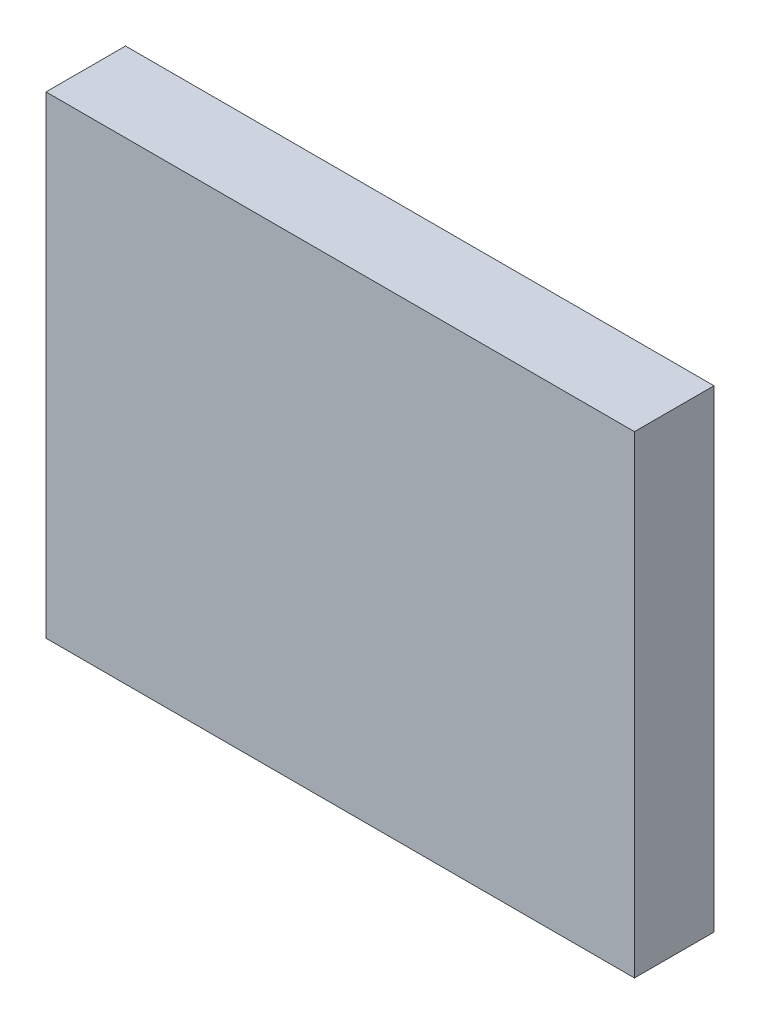
from build123d import *

# Parameters (mm, degrees)
SKETCH_1_W      = 1480
SKETCH_1_H      = 1190
EXTRUDE_1_DEPTH = 200


with BuildPart() as part:
    # Эскиз1 → Бобышка-Вытянуть1 (new body)
    with BuildSketch(Plane.XY):
        with Locations((0, 595)):
            Rectangle(SKETCH_1_W, SKETCH_1_H)
    extrude(amount=EXTRUDE_1_DEPTH)


solid = part.part
